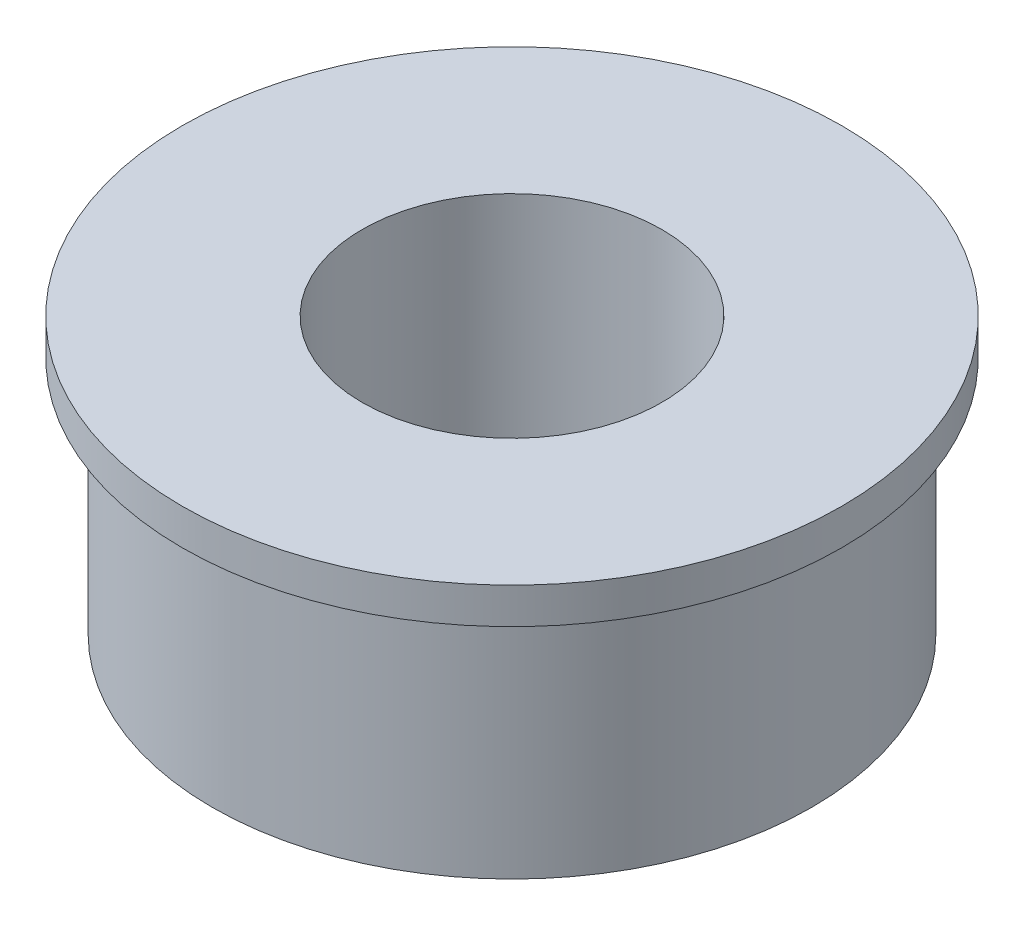
from build123d import *

# Parameters (mm, degrees)
SKETCH1_R           = 5
SKETCH1_R_2         = 2.5
BOSS_EXTRUDE1_DEPTH = 4
SKETCH2_R           = 5.5
SKETCH2_R_2         = 2.5
BOSS_EXTRUDE2_DEPTH = 0.6


with BuildPart() as part:
    # Sketch1 → Boss-Extrude1 (new body)
    with BuildSketch(Plane(origin=(0, 0, 0), x_dir=(1, 0, 0), z_dir=(0, 1, 0))):
        with Locations(Location((0, 0, 0), (0, 0, 270))):
            Circle(SKETCH1_R)
        with Locations(Location((0, 0, 0), (0, 0, 270))):
            Circle(SKETCH1_R_2, mode=Mode.SUBTRACT)
    extrude(amount=BOSS_EXTRUDE1_DEPTH)

    # Sketch2 → Boss-Extrude2 (add)
    with BuildSketch(Plane(origin=(0, 4, 0), x_dir=(1, 0, 0), z_dir=(0, 1, 0))):
        with Locations(Location((0, 0, 0), (0, 0, 270))):
            Circle(SKETCH2_R)
        with Locations(Location((0, 0, 0), (0, 0, 270))):
            Circle(SKETCH2_R_2, mode=Mode.SUBTRACT)
    extrude(amount=BOSS_EXTRUDE2_DEPTH)


solid = part.part
